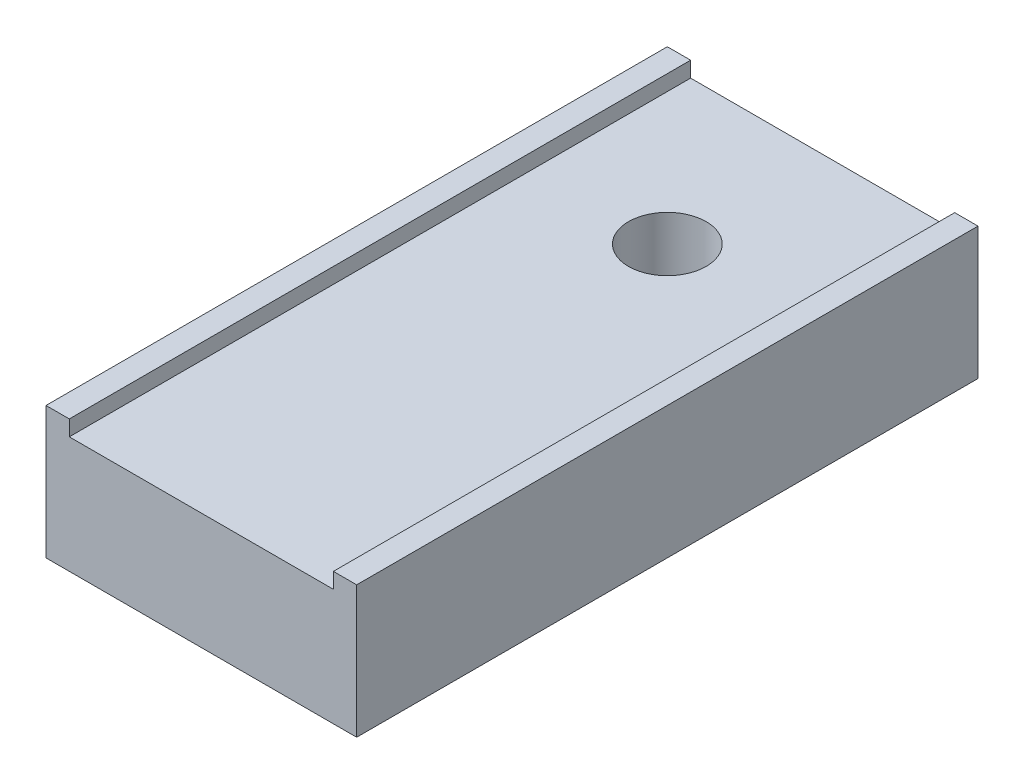
from build123d import *

# Parameters (mm, degrees)
SKETCH1_W               = 25.4
SKETCH1_H               = 50.8
BOSS_EXTRUDE1_DEPTH     = 9.525
SKETCH2_W               = 1.905
SKETCH2_H               = 50.8
BOSS_EXTRUDE2_DEPTH     = 1.27
CUT_EXTRUDE1_DEPTH      = 30.952890094
CUT_EXTRUDE1_DEPTH_BACK = 30.952890094
SKETCH3_R               = 3.175


with BuildPart() as part:
    # Sketch1 → Boss-Extrude1 (new body)
    with BuildSketch(Plane(origin=(0, 0, 0), x_dir=(1, 0, 0), z_dir=(0, 1, 0))):
        Rectangle(SKETCH1_W, SKETCH1_H)
    extrude(amount=BOSS_EXTRUDE1_DEPTH)

    # Sketch2 → Boss-Extrude2 (add)
    with BuildSketch(Plane(origin=(0, 9.525, 0), x_dir=(1, 0, 0), z_dir=(0, 1, 0))):
        with Locations((-11.7475, 0)):
            Rectangle(SKETCH2_W, SKETCH2_H)
        with Locations((11.7475, 0)):
            Rectangle(SKETCH2_W, SKETCH2_H)
    extrude(amount=BOSS_EXTRUDE2_DEPTH)

    # Sketch3 → Cut-Extrude1 (cut, two sides: drawn at the far end of the back side and taken through both)
    with BuildSketch(Plane(origin=(0, 9.525, 0), x_dir=(1, 0, 0), z_dir=(0, 1, 0)).offset(-CUT_EXTRUDE1_DEPTH_BACK)):
        with Locations(Location((0, 12.7, 0), (0, 0, 270))):
            Circle(SKETCH3_R)
    extrude(amount=CUT_EXTRUDE1_DEPTH + CUT_EXTRUDE1_DEPTH_BACK, mode=Mode.SUBTRACT)


solid = part.part
